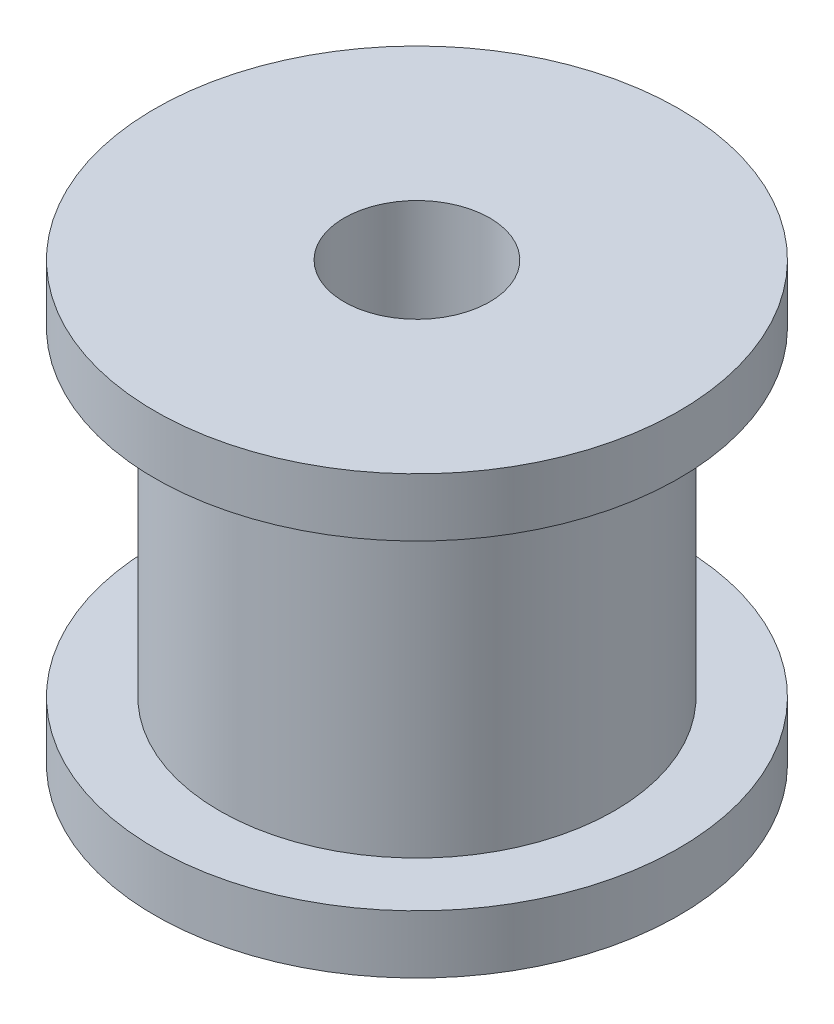
from build123d import *


with BuildPart() as part:
    # 草图1 → 旋转1 (revolve)
    with BuildSketch(Plane.XY, mode=Mode.PRIVATE) as revolve_1_sk:
        Polygon((2.5, 7.5), (9, 7.5), (9, 5.5), (6.78, 5.5), (6.78, -5.5), (9, -5.5), (9, -7.5), (2.5, -7.5), align=None)
    revolve(revolve_1_sk.sketch.rotate(Axis((0, 0, 0), (0, 1, 0)), 90), axis=Axis((0, 0, 0), (0, 1, 0)))


solid = part.part
